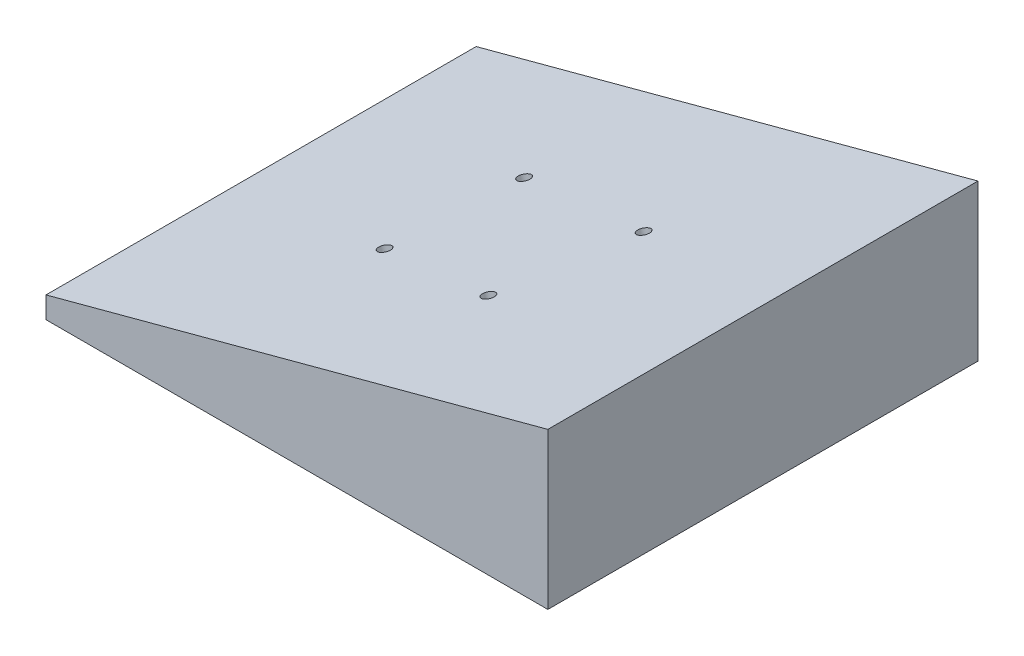
from build123d import *

# Parameters (mm, degrees)
EXTRUDE_1_DEPTH     = 60
SKETCH_2_R          = 0.85
CUT_EXTRUDE_1_DEPTH = 30


with BuildPart() as part:
    # 草图1 → 凸台-拉伸1 (new body)
    with BuildSketch(Plane.XY):
        Polygon((0, 0), (70, 0), (70, 21.75644347), (0, 3), align=None)
    extrude(amount=EXTRUDE_1_DEPTH)

    # 草图2 → 切除-拉伸1 (cut, symmetric)
    with BuildSketch(Plane(origin=(-0.75, 2.799038106, 0), x_dir=(0.9659258262890683, 0.25881904510252085, 0), z_dir=(-0.2588190451025208, 0.9659258262890682, 0))):
        with Locations(Location((27.89012345, -19.503, 0), (0, 0, 180))):
            Circle(SKETCH_2_R)
        with Locations(Location((48.89812345, -23.123, 0), (0, 0, 180))):
            Circle(SKETCH_2_R)
        with Locations(Location((44.47112345, -40.502, 0), (0, 0, 180))):
            Circle(SKETCH_2_R)
        with Locations(Location((26.27012345, -37.391, 0), (0, 0, 180))):
            Circle(SKETCH_2_R)
    extrude(amount=CUT_EXTRUDE_1_DEPTH, both=True, mode=Mode.SUBTRACT)


solid = part.part
